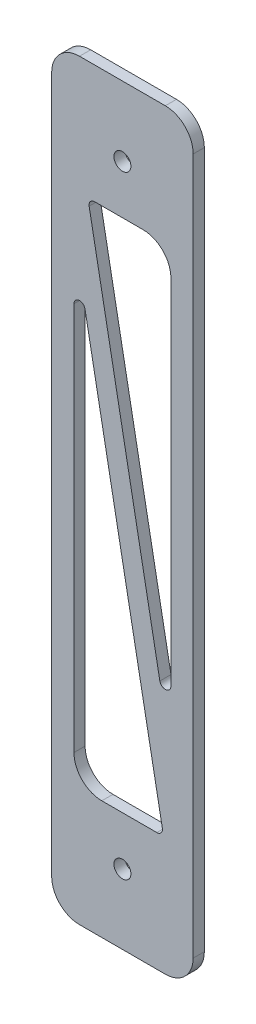
from build123d import *

# Parameters (mm, degrees)
SKETCH1_R           = 3.05
BOSS_EXTRUDE1_DEPTH = 4


with BuildPart() as part:
    # Sketch1 → Boss-Extrude1 (new body)
    with BuildSketch(Plane.XY):
        with BuildLine():
            Line((15.4, -135), (-15.4, -135))
            ThreePointArc((-15.4, -135), (-22.471067812, -132.071067812), (-25.4, -125))
            Line((-25.4, -125), (-25.4, 125))
            ThreePointArc((-25.4, 125), (-22.471067812, 132.071067812), (-15.4, 135))
            Line((-15.4, 135), (15.4, 135))
            ThreePointArc((15.4, 135), (22.471067812, 132.071067812), (25.4, 125))
            Line((25.4, 125), (25.4, -125))
            ThreePointArc((25.4, -125), (22.471067812, -132.071067812), (15.4, -135))
        make_face()
        with Locations((0, 110)):
            Circle(SKETCH1_R, mode=Mode.SUBTRACT)
        with Locations((0, -110)):
            Circle(SKETCH1_R, mode=Mode.SUBTRACT)
        with BuildLine():
            Line((-13.434486763, 57.416947085), (14.322530577, -90.110507285))
            ThreePointArc((14.322530577, -90.110507285), (13.896435307, -91.757104812), (12.357017341, -92.480314961))
            Line((12.357017341, -92.480314961), (-7.4, -92.480314961))
            ThreePointArc((-7.4, -92.480314961), (-14.471067812, -89.551382772), (-17.4, -82.480314961))
            Line((-17.4, -82.480314961), (-17.4, 57.047139409))
            ThreePointArc((-17.4, 57.047139409), (-15.585706121, 59.038499055), (-13.434486763, 57.416947085))
        make_face(mode=Mode.SUBTRACT)
        with BuildLine():
            Line((17.4, -44.459157406), (17.4, 82.480314961))
            ThreePointArc((17.4, 82.480314961), (14.471067812, 89.551382772), (7.4, 92.480314961))
            Line((7.4, 92.480314961), (-9.988611838, 92.480314961))
            ThreePointArc((-9.988611838, 92.480314961), (-11.528029804, 91.757104812), (-11.954125074, 90.110507285))
            Line((-11.954125074, 90.110507285), (13.434486763, -44.828965081))
            ThreePointArc((13.434486763, -44.828965081), (15.585706121, -46.450517051), (17.4, -44.459157406))
        make_face(mode=Mode.SUBTRACT)
    extrude(amount=BOSS_EXTRUDE1_DEPTH)


solid = part.part
